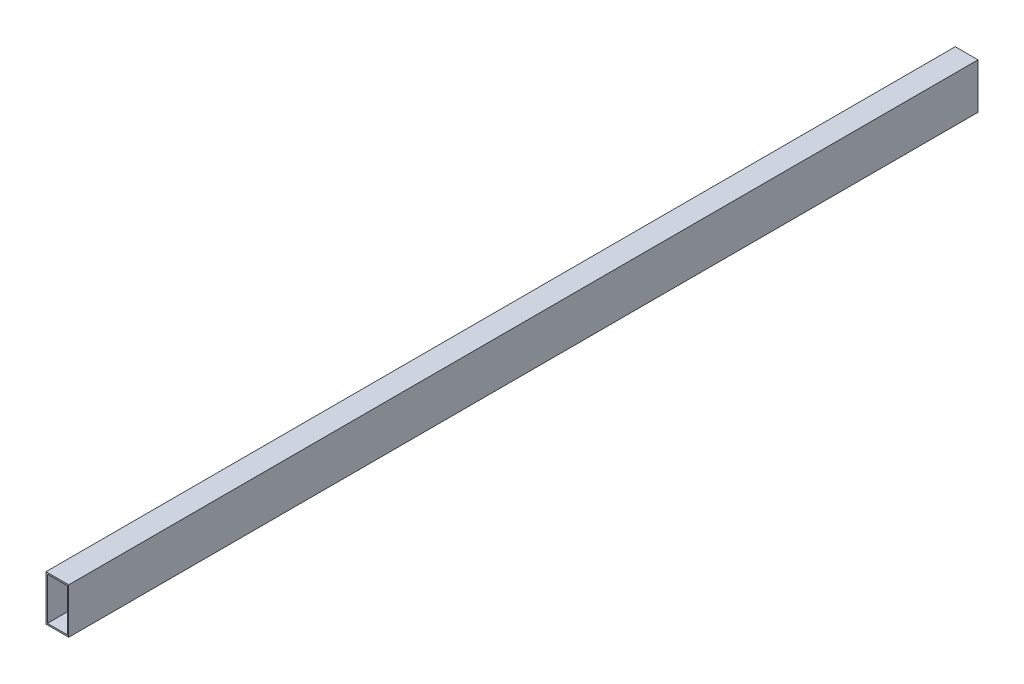
from build123d import *

# Parameters (mm, degrees)
SKETCH1_W           = 25.4
SKETCH1_H           = 50.8
SKETCH1_W_2         = 22.225
SKETCH1_H_2         = 47.625
BOSS_EXTRUDE1_DEPTH = 1016


with BuildPart() as part:
    # Sketch1 → Boss-Extrude1 (new body)
    with BuildSketch(Plane.XY):
        with Locations((12.7, 25.4)):
            Rectangle(SKETCH1_W, SKETCH1_H)
        with Locations((12.7, 25.4)):
            Rectangle(SKETCH1_W_2, SKETCH1_H_2, mode=Mode.SUBTRACT)
    extrude(amount=BOSS_EXTRUDE1_DEPTH)


solid = part.part
